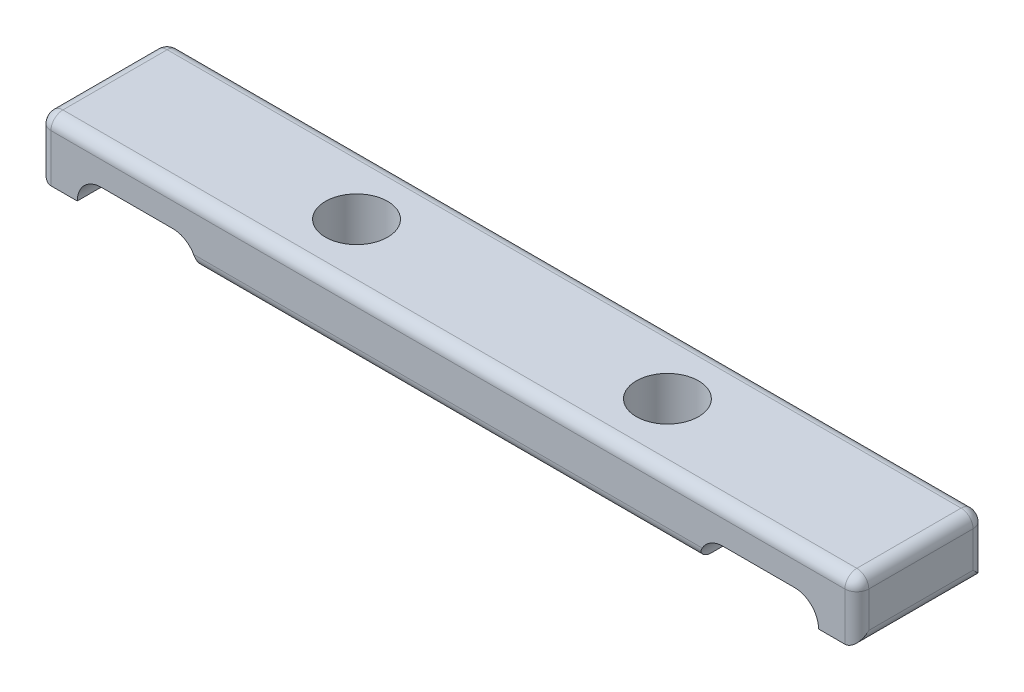
from build123d import *

# Parameters (mm, degrees)
SKETCH1_W           = 68.4
SKETCH1_H           = 10.72
BOSS_EXTRUDE1_DEPTH = 5
CUT_EXTRUDE3_REACH  = 36.977
SKETCH6_R           = 2.6
CUT_EXTRUDE4_DEPTH  = 37.187821156
FILLET1_R           = 1
FILLET2_R           = 1
FILLET3_R           = 1


with BuildPart() as part:
    # Sketch1 → Boss-Extrude1 (new body)
    with BuildSketch(Plane(origin=(0, 0, 0), x_dir=(1, 0, 0), z_dir=(0, 1, 0))):
        Rectangle(SKETCH1_W, SKETCH1_H)
    extrude(amount=BOSS_EXTRUDE1_DEPTH)

    # Sketch6 → Cut-Extrude3 (cut, up to next)
    with BuildSketch(Plane(origin=(0, 0, 0), x_dir=(1, 0, 0), z_dir=(0, 1, 0)), mode=Mode.PRIVATE) as cut_extrude3_sk1:
        with Locations(Location((-13, 0, 0), (0, 0, 270))):
            Circle(SKETCH6_R)
    cut_extrude3_tool1 = extrude(cut_extrude3_sk1.sketch, amount=CUT_EXTRUDE3_REACH, mode=Mode.PRIVATE) & part.part
    cut_extrude3 = cut_extrude3_tool1.solids().sort_by_distance((-13, 0, 0))[0]
    add(cut_extrude3, mode=Mode.SUBTRACT)

    # Sketch9 → Cut-Extrude4 (cut, through all)
    with BuildSketch(Plane.XY.offset(5.36)):
        with BuildLine():
            Line((-23, 2), (-29, 2))
            ThreePointArc((-29, 2), (-30.414213562, 1.414213562), (-31, 0))
            Line((-31, 0), (-21, 0))
            ThreePointArc((-21, 0), (-21.585786438, 1.414213562), (-23, 2))
        make_face()
    cut_extrude4 = extrude(amount=-CUT_EXTRUDE4_DEPTH, mode=Mode.SUBTRACT)

    # Mirror4: Cut-Extrude4 across plane
    add(cut_extrude4.mirror(Plane(origin=(0, 0, 0), x_dir=(0, 0, 1), z_dir=(1, 0, 0))), mode=Mode.SUBTRACT)

    # Fillet1
    fillet1_edges = [part.edges().sort_by_distance(p)[0] for p in [
        (-34.2, 5, 0),
    ]]
    fillet(fillet1_edges, radius=FILLET1_R)

    # Fillet2
    fillet2_edges = [part.edges().sort_by_distance(p)[0] for p in [
        (34.2, 5, 0),
    ]]
    fillet(fillet2_edges, radius=FILLET2_R)

    # Mirror5: Cut-Extrude3 across plane
    add(cut_extrude3.mirror(Plane(origin=(0, 0, 0), x_dir=(0, 0, 1), z_dir=(1, 0, 0))), mode=Mode.SUBTRACT)

    # Fillet3
    fillet3_edges = [part.edges().sort_by_distance(p)[0] for p in [
        (-34.2, 2, 5.36),
        (-33.907106781, 4.707106781, 5.36),
        (34.2, 2, 5.36),
        (33.907106781, 4.707106781, 5.36),
        (34.2, 2, -5.36),
        (33.907106781, 4.707106781, -5.36),
        (-34.2, 2, -5.36),
        (-33.907106781, 4.707106781, -5.36),
        (34.2, 0, 0),
        (-34.2, 0, 0),
        (0, 5, 5.36),
        (0, 5, -5.36),
        (0, 0, 5.36),
        (0, 0, -5.36),
    ]]
    fillet(fillet3_edges, radius=FILLET3_R)


solid = part.part
